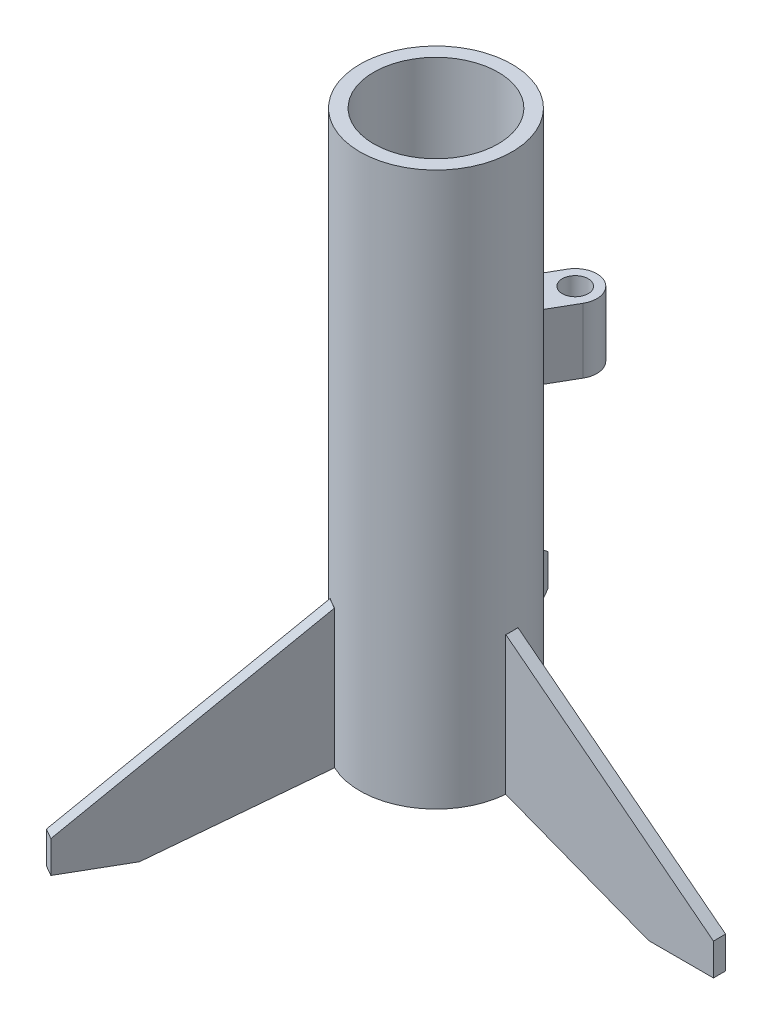
from build123d import *

# Parameters (mm, degrees)
SKETCH1_R           = 11.1633
SKETCH1_R_2         = 9.1313
BOSS_EXTRUDE1_DEPTH = 81.28
BOSS_EXTRUDE2_DEPTH = 0.889
CIRPATTERN1_COUNT   = 3
SKETCH3_R           = 9.1313
SKETCH3_R_2         = 6.35
BOSS_EXTRUDE3_DEPTH = 3.175
BOSS_EXTRUDE4_START = -0.461027
SKETCH5_W           = 9.525
SKETCH5_H           = 6.35
BOSS_EXTRUDE4_DEPTH = 4.271027
BOSS_EXTRUDE5_DEPTH = 9.525
SKETCH7_R           = 1.905
CUT_EXTRUDE1_DEPTH  = 9.525


with BuildPart() as part:
    # Sketch1 → Boss-Extrude1 (new body)
    with BuildSketch(Plane(origin=(0, 0, 0), x_dir=(1, 0, 0), z_dir=(0, 1, 0))):
        with Locations(Location((0, 0, 0), (0, 0, 270))):
            Circle(SKETCH1_R)
        with Locations(Location((0, 0, 0), (0, 0, 270))):
            Circle(SKETCH1_R_2, mode=Mode.SUBTRACT)
    extrude(amount=BOSS_EXTRUDE1_DEPTH)

    # Sketch2 → Boss-Extrude2 (add, symmetric)
    with BuildSketch(Plane.XY):
        Polygon((11.1633, 0), (9.1313, 0), (9.1313, 20.32), (11.1633, 20.32), (41.6433, -3.408032613), (41.6433, -8.103225478), (32.1183, -8.103225478), align=None)
    boss_extrude2 = extrude(amount=BOSS_EXTRUDE2_DEPTH, both=True)

    # CirPattern1: Boss-Extrude2 ×3 about axis
    cirpattern1_axis = Axis((0, 0, 0), (0, 1, 0))
    for i in range(1, CIRPATTERN1_COUNT):
        add(boss_extrude2.rotate(cirpattern1_axis, i * 360 / CIRPATTERN1_COUNT))

    # Sketch3 → Boss-Extrude3 (add)
    with BuildSketch(Plane(origin=(0, 63.5, 0), x_dir=(1, 0, 0), z_dir=(0, 1, 0))):
        with Locations(Location((0, 0, 0), (0, 0, 270))):
            Circle(SKETCH3_R)
        with Locations(Location((0, 0, 0), (0, 0, 270))):
            Circle(SKETCH3_R_2, mode=Mode.SUBTRACT)
    extrude(amount=BOSS_EXTRUDE3_DEPTH)

    # Sketch5 → Boss-Extrude4 (add)
    with BuildSketch(Plane(origin=(5.58165, 0, -9.66770139), x_dir=(0, -1, 0), z_dir=(0.500000000000001, 0, -0.866025403784438)).offset(BOSS_EXTRUDE4_START)):
        with Locations((-51.1175, 0)):
            Rectangle(SKETCH5_W, SKETCH5_H)
    extrude(amount=BOSS_EXTRUDE4_DEPTH)

    # Sketch6 → Boss-Extrude5 (add)
    with BuildSketch(Plane(origin=(0, 55.88, 0), x_dir=(1, 0, 0), z_dir=(0, 1, 0))):
        with BuildLine():
            Line((4.737019343, 14.554758178), (10.236280657, 11.379758178))
            ThreePointArc((10.236280657, 11.379758178), (9.07415, 15.716888836), (4.737019343, 14.554758178))
        make_face()
    extrude(amount=-BOSS_EXTRUDE5_DEPTH)

    # Sketch7 → Cut-Extrude1 (cut)
    with BuildSketch(Plane(origin=(0, 55.88, 0), x_dir=(1, 0, 0), z_dir=(0, 1, 0))):
        with Locations(Location((7.48665, 12.967258178, 0), (0, 0, 270))):
            Circle(SKETCH7_R)
    extrude(amount=-CUT_EXTRUDE1_DEPTH, mode=Mode.SUBTRACT)


solid = part.part
